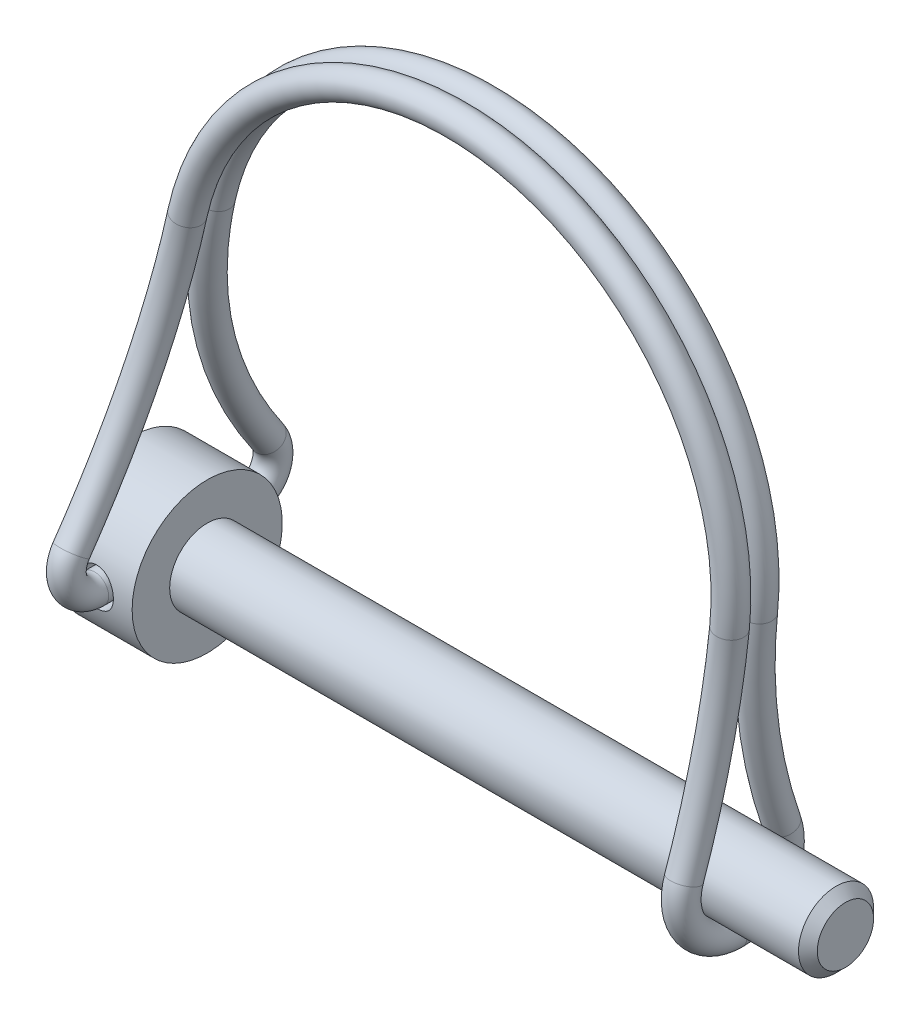
from build123d import *

# Parameters (mm, degrees)
CUT_EXTRUDE1_DEPTH      = 61.989758362
CUT_EXTRUDE1_DEPTH_BACK = 61.989758362
SKETCH2_R               = 1.5875
CHAMFER1_SIZE           = 0.79375
SKETCH3_R               = 1.190625


with BuildPart() as part:
    # Sketch1 → Revolve1 (revolve)
    with BuildSketch(Plane.XY, mode=Mode.PRIVATE) as revolve1_sk:
        Polygon((0, 0), (0, 6.35), (6.35, 6.35), (6.35, 3.175), (60.325, 3.175), (60.325, 0), align=None)
    revolve(revolve1_sk.sketch.rotate(Axis((0, 0, 0), (1, 0, 0)), 90), axis=Axis((0, 0, 0), (1, 0, 0)))

    # Sketch2 → Cut-Extrude1 (cut, two sides: drawn at the far end of the back side and taken through both)
    with BuildSketch(Plane.XY.offset(-CUT_EXTRUDE1_DEPTH_BACK)):
        with Locations((3.175, 0)):
            Circle(SKETCH2_R)
    extrude(amount=CUT_EXTRUDE1_DEPTH + CUT_EXTRUDE1_DEPTH_BACK, mode=Mode.SUBTRACT)

    # Chamfer1
    chamfer1_edges = [part.edges().sort_by_distance(p)[0] for p in [
        (60.325, 0, -3.175),
    ]]
    chamfer(chamfer1_edges, length=CHAMFER1_SIZE)


with BuildPart() as body_2:
    # Sweep1: sweep along a curve in space
    with BuildLine() as sweep1_path:
        Line((3.175, 0, 0), (3.175, 0, 6.35))
        ThreePointArc((3.175, 0, 6.35), (3.175, 1.28384402, 8.469477967), (3.175, 3.756906703, 8.313262449))
        ThreePointArc((3.175, 3.756906703, 8.313262449), (3.863675449, 14.495656711, 3.017751381), (5.859644914, 26.179627704, 1.190625))
        ThreePointArc((51.713966002, 18.799668831, 1.190625), (32.271053273, 44.138524743, 1.190625), (5.859644914, 26.179627704, 1.190625))
        ThreePointArc((50.8, 1.430332338, 4.124661325), (51.030235189, 10.003972806, 1.929731713), (51.713966002, 18.799668831, 1.190625))
        ThreePointArc((50.8, 1.430332338, 4.124661325), (50.8, -2.531243472, 3.556893044), (50.8, -4.365625, 0))
    # Sketch3 → Sweep1 (sweep)
    with BuildSketch(Plane.XY):
        with Locations((3.175, 0)):
            Circle(SKETCH3_R)
    sweep(path=sweep1_path.line)


with BuildPart() as body_3:
    # Mirror4: mirrored copy
    add(body_2.part.mirror(Plane.XY))


solid = Compound([part.part, body_2.part, body_3.part])
